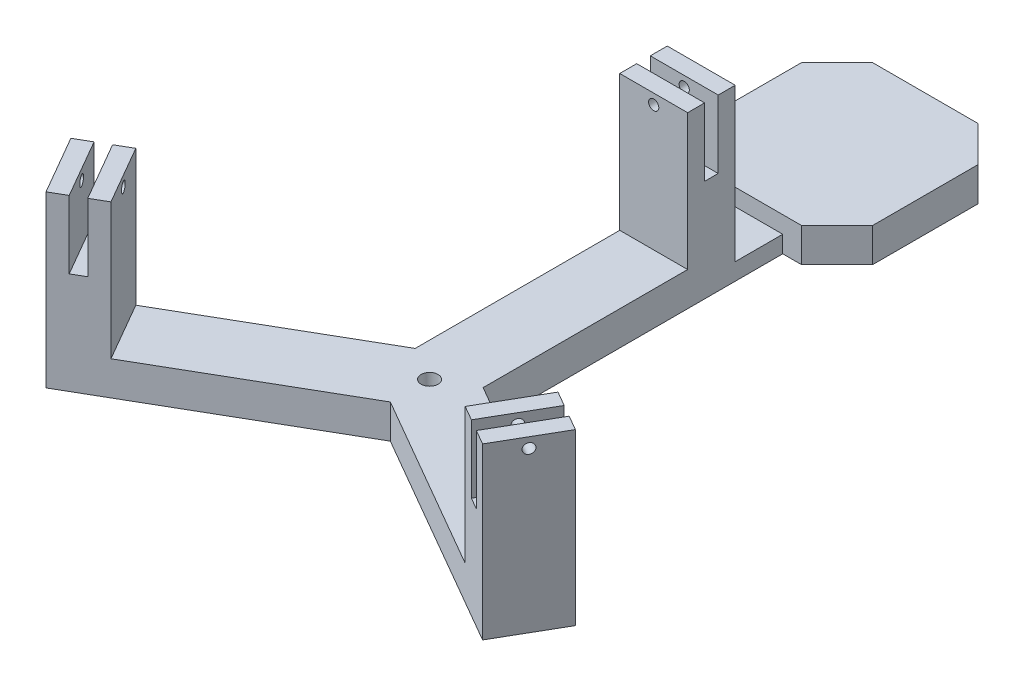
from build123d import *

# Parameters (mm, degrees)
BOSS_EXTRUDE1_DEPTH = 10
SKETCH2_W           = 20
SKETCH2_H           = 14
BOSS_EXTRUDE2_DEPTH = 20
SKETCH3_W           = 20
SKETCH3_H           = 5
BOSS_EXTRUDE3_DEPTH = 20
SKETCH4_R           = 1.5
CUT_EXTRUDE1_DEPTH  = 84.402637848
CIRPATTERN1_COUNT   = 3
SKETCH5_R           = 2.5
CUT_EXTRUDE2_DEPTH  = 117.266161556
SKETCH8_W           = 20
SKETCH8_H           = 14
BOSS_EXTRUDE7_DEPTH = 5
BOSS_EXTRUDE8_DEPTH = 10


with BuildPart() as part:
    # Sketch1 → Boss-Extrude1 (new body)
    with BuildSketch(Plane(origin=(0, 0, 0), x_dir=(1, 0, 0), z_dir=(0, 1, 0))):
        Polygon((0, 0), (-10, 5.773502692), (-10, 80), (10, 80), (10, 5.773502692), align=None)
    boss_extrude1 = extrude(amount=BOSS_EXTRUDE1_DEPTH)

    # Sketch2 → Boss-Extrude2 (add)
    with BuildSketch(Plane(origin=(0, 10, 0), x_dir=(1, 0, 0), z_dir=(0, 1, 0))):
        with Locations((0, 73)):
            Rectangle(SKETCH2_W, SKETCH2_H)
    boss_extrude2 = extrude(amount=BOSS_EXTRUDE2_DEPTH)

    # Sketch3 → Boss-Extrude3 (add)
    with BuildSketch(Plane(origin=(0, 30, 0), x_dir=(1, 0, 0), z_dir=(0, 1, 0))):
        with Locations((0, 77.5)):
            Rectangle(SKETCH3_W, SKETCH3_H)
        with Locations((0, 68.5)):
            Rectangle(SKETCH3_W, SKETCH3_H)
    boss_extrude3 = extrude(amount=BOSS_EXTRUDE3_DEPTH)

    # Sketch4 → Cut-Extrude1 (cut, symmetric)
    with BuildSketch(Plane.XY.offset(-66)):
        with Locations((0, 47)):
            Circle(SKETCH4_R)
    cut_extrude1 = extrude(amount=CUT_EXTRUDE1_DEPTH, both=True, mode=Mode.SUBTRACT)

    # CirPattern1: Boss-Extrude1, Boss-Extrude2, Boss-Extrude3, Cut-Extrude1 ×3 about axis
    cirpattern1_axis = Axis((0, 0, 0), (0, 1, 0))
    add([boss_extrude1.rotate(cirpattern1_axis, i * 360 / CIRPATTERN1_COUNT) for i in range(1, CIRPATTERN1_COUNT)])
    add([boss_extrude2.rotate(cirpattern1_axis, i * 360 / CIRPATTERN1_COUNT) for i in range(1, CIRPATTERN1_COUNT)])
    add([boss_extrude3.rotate(cirpattern1_axis, i * 360 / CIRPATTERN1_COUNT) for i in range(1, CIRPATTERN1_COUNT)])
    add([cut_extrude1.rotate(cirpattern1_axis, i * 360 / CIRPATTERN1_COUNT) for i in range(1, CIRPATTERN1_COUNT)], mode=Mode.SUBTRACT)

    # Sketch5 → Cut-Extrude2 (cut, through all)
    with BuildSketch(Plane(origin=(0, 10, 0), x_dir=(1, 0, 0), z_dir=(0, 1, 0))):
        with Locations(Location((0, 0, 0), (0, 0, 270))):
            Circle(SKETCH5_R)
    extrude(amount=-CUT_EXTRUDE2_DEPTH, mode=Mode.SUBTRACT)

    # Sketch8 → Boss-Extrude7 (add)
    with BuildSketch(Plane(origin=(0, 0, 0), x_dir=(1, 0, 0), z_dir=(0, 1, 0))):
        with Locations((0, 87)):
            Rectangle(SKETCH8_W, SKETCH8_H)
    extrude(amount=BOSS_EXTRUDE7_DEPTH)

    # Sketch11 → Boss-Extrude8 (add)
    with BuildSketch(Plane(origin=(0, 0, 0), x_dir=(1, 0, 0), z_dir=(0, 1, 0))):
        Polygon((-15.5, 94), (15.5, 94), (26, 104.5), (26, 135.5), (15.5, 146), (-15.5, 146), (-26, 135.5), (-26, 104.5), align=None)
    extrude(amount=BOSS_EXTRUDE8_DEPTH)


solid = part.part
